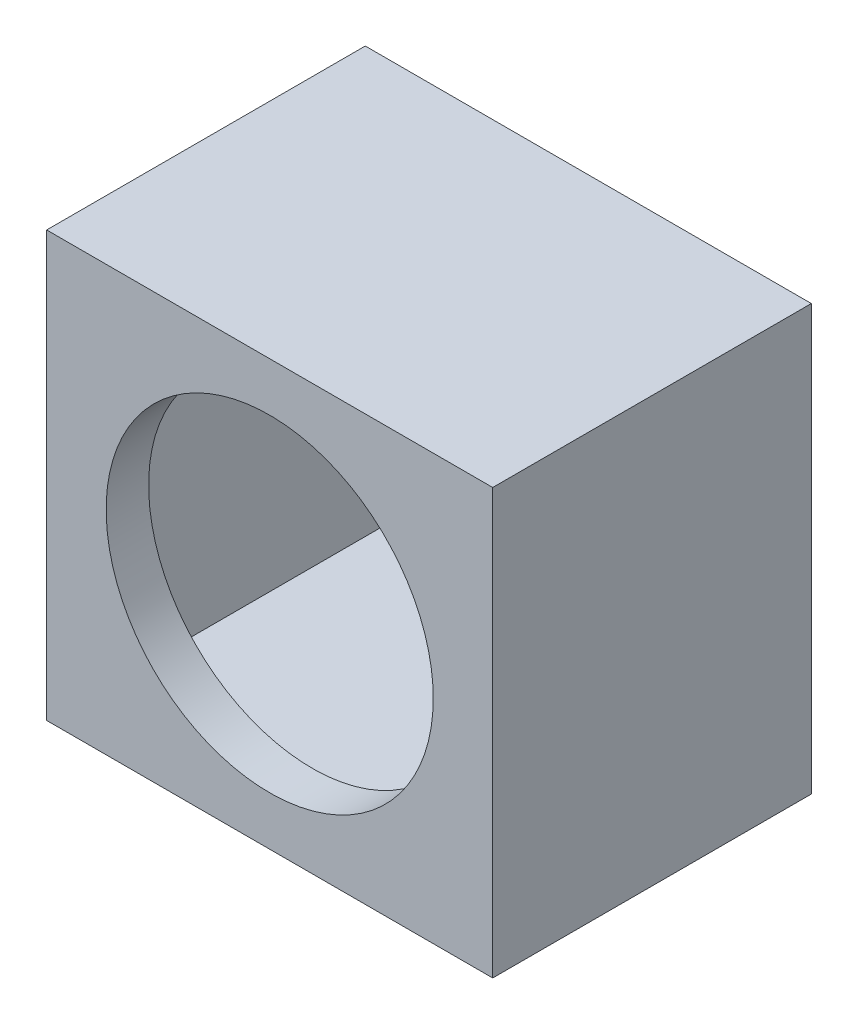
from build123d import *

# Parameters (mm, degrees)
SKETCH1_W           = 10.5
SKETCH1_H           = 10
BOSS_EXTRUDE1_DEPTH = 7.5
SHELL1_T            = 1
CUT_EXTRUDE1_REACH  = 12.431
SKETCH2_R           = 3.85
SKETCH3_W           = 8.5
SKETCH3_H           = 8
CUT_EXTRUDE2_DEPTH  = 1


with BuildPart() as part:
    # Sketch1 → Boss-Extrude1 (new body)
    with BuildSketch(Plane.XY):
        Rectangle(SKETCH1_W, SKETCH1_H)
    extrude(amount=BOSS_EXTRUDE1_DEPTH)

    # Shell1 (no face opened: a closed hollow body)
    add(offset(amount=-SHELL1_T, mode=Mode.PRIVATE), mode=Mode.SUBTRACT)

    # Sketch2 → Cut-Extrude1 (cut, up to next)
    with BuildSketch(Plane.XY.offset(7.5), mode=Mode.PRIVATE) as cut_extrude1_sk1:
        Circle(SKETCH2_R)
    cut_extrude1_tool1 = extrude(cut_extrude1_sk1.sketch, amount=-CUT_EXTRUDE1_REACH, mode=Mode.PRIVATE) & part.part
    add(cut_extrude1_tool1.solids().sort_by_distance((0, 0, 7.5))[0], mode=Mode.SUBTRACT)

    # Sketch3 → Cut-Extrude2 (cut)
    with BuildSketch(Plane.XY):
        Rectangle(SKETCH3_W, SKETCH3_H)
    extrude(amount=CUT_EXTRUDE2_DEPTH, mode=Mode.SUBTRACT)


solid = part.part
